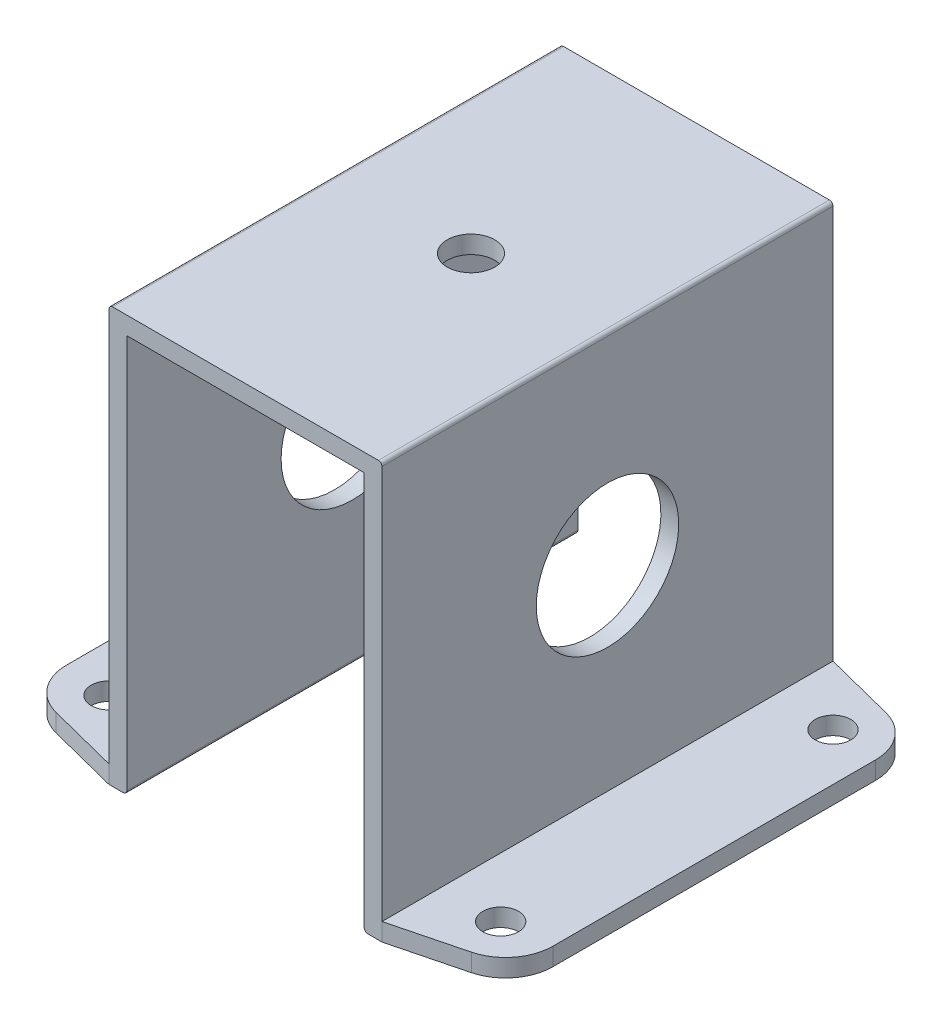
from build123d import *

# Parameters (mm, degrees)
BOSS_EXTRUDE1_DEPTH = 19
SKETCH4_R           = 2
CUT_EXTRUDE1_DEPTH  = 1.5
FILLET1_R           = 0.3
FILLET2_R           = 0.3
FILLET3_R           = 0.3
SKETCH3_R           = 1.5
BOSS_EXTRUDE2_DEPTH = 1.5
SKETCH7_R           = 6
CUT_EXTRUDE2_DEPTH  = 52.088159098


with BuildPart() as part:
    # Sketch1 → Boss-Extrude1 (new, symmetric)
    with BuildSketch(Plane.XY):
        Polygon((-10, 0), (-10, 33.5), (10, 33.5), (10, 0), (11.5, 0), (11.5, 35), (-11.5, 35), (-11.5, 0), align=None)
    extrude(amount=BOSS_EXTRUDE1_DEPTH, both=True)

    # Sketch4 → Cut-Extrude1 (cut)
    with BuildSketch(Plane(origin=(0, 35, 0), x_dir=(1, 0, 0), z_dir=(0, 1, 0))):
        with Locations(Location((0, 0, 0), (0, 0, 270))):
            Circle(SKETCH4_R)
    extrude(amount=-CUT_EXTRUDE1_DEPTH, mode=Mode.SUBTRACT)

    # Fillet1
    fillet1_edges = [part.edges().sort_by_distance(p)[0] for p in [
        (-10, 0, 0),
    ]]
    fillet(fillet1_edges, radius=FILLET1_R)

    # Fillet2
    fillet2_edges = [part.edges().sort_by_distance(p)[0] for p in [
        (10, 0, 0),
    ]]
    fillet(fillet2_edges, radius=FILLET2_R)

    # Fillet3
    fillet3_edges = [part.edges().sort_by_distance(p)[0] for p in [
        (-11.5, 35, 0),
        (11.5, 35, 0),
    ]]
    fillet(fillet3_edges, radius=FILLET3_R)

    # Sketch3 → Boss-Extrude2 (add)
    # profile 1 of 2: a face of its own
    with BuildSketch(Plane(origin=(0, 0, 0), x_dir=(1, 0, 0), z_dir=(0, 1, 0))):
        with BuildLine():
            ThreePointArc((-17.49039307, -17.469121771), (-19.659238221, -16.047079248), (-20.5, -13.593670627))
            Line((-20.5, -13.593670627), (-20.5, 13.593670627))
            ThreePointArc((-20.5, 13.593670627), (-19.659238221, 16.047079248), (-17.49039307, 17.469121771))
            Line((-17.49039307, 17.469121771), (-11.5, 19))
            Line((-11.5, 19), (-11.5, -19))
            Line((-11.5, -19), (-17.49039307, -17.469121771))
        make_face()
        with Locations(Location((-16.5, -14, 0), (0, 0, 270))):
            Circle(SKETCH3_R, mode=Mode.SUBTRACT)
        with Locations(Location((-16.5, 14, 0), (0, 0, 270))):
            Circle(SKETCH3_R, mode=Mode.SUBTRACT)
    # profile 2 of 2: a face of its own
    with BuildSketch(Plane(origin=(0, 0, 0), x_dir=(1, 0, 0), z_dir=(0, 1, 0))):
        with BuildLine():
            Line((17.49039307, -17.469121771), (11.5, -19))
            Line((11.5, -19), (11.5, 19))
            Line((11.5, 19), (17.49039307, 17.469121771))
            ThreePointArc((17.49039307, 17.469121771), (19.659238221, 16.047079248), (20.5, 13.593670627))
            Line((20.5, 13.593670627), (20.5, -13.593670627))
            ThreePointArc((20.5, -13.593670627), (19.659238221, -16.047079248), (17.49039307, -17.469121771))
        make_face()
        with Locations(Location((16.5, -14, 0), (0, 0, 270))):
            Circle(SKETCH3_R, mode=Mode.SUBTRACT)
        with Locations(Location((16.5, 14, 0), (0, 0, 270))):
            Circle(SKETCH3_R, mode=Mode.SUBTRACT)
    extrude(amount=BOSS_EXTRUDE2_DEPTH)

    # Sketch7 → Cut-Extrude2 (cut, through all)
    with BuildSketch(Plane.ZY.offset(11.5)):
        with Locations(Location((0, 18, 0), (0, 0, 270))):
            Circle(SKETCH7_R)
    extrude(amount=-CUT_EXTRUDE2_DEPTH, mode=Mode.SUBTRACT)


solid = part.part
